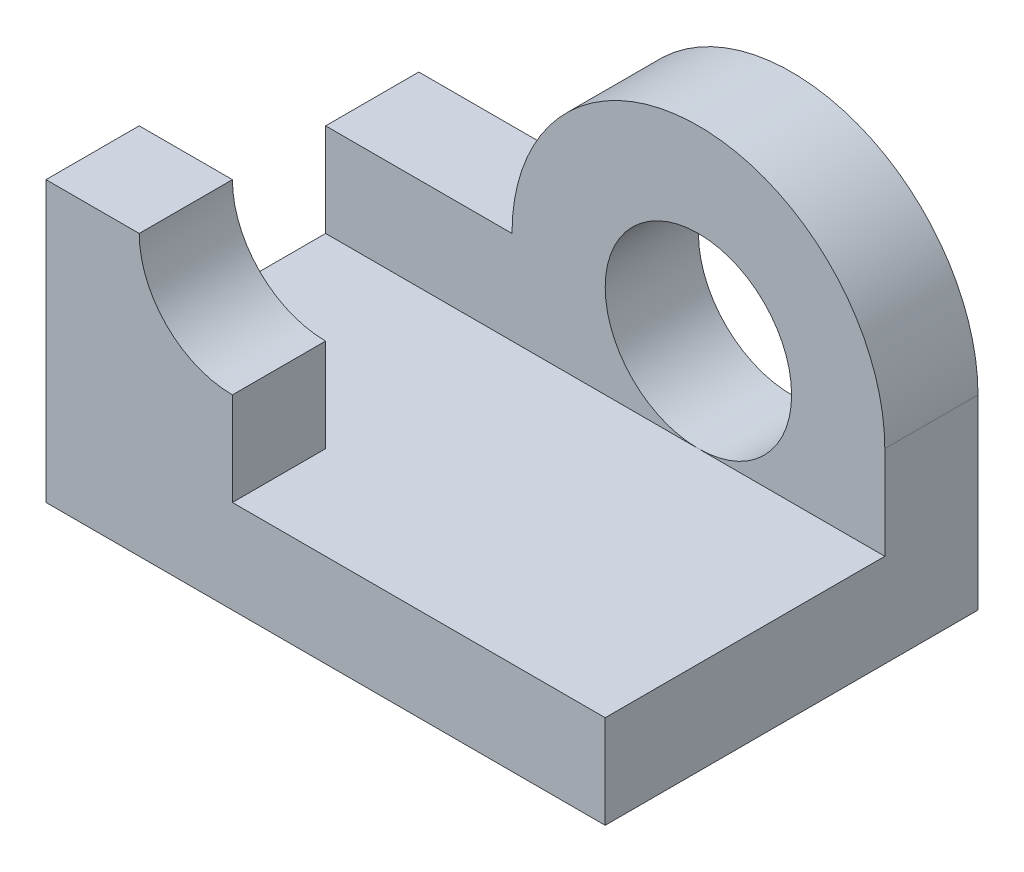
from build123d import *

# Parameters (mm, degrees)
SKETCH_1_W      = 60
SKETCH_1_H      = 40
EXTRUDE_1_DEPTH = 10
EXTRUDE_2_DEPTH = 10
SKETCH_3_W      = 20
SKETCH_3_H      = 10
EXTRUDE_6_DEPTH = 10
EXTRUDE_7_DEPTH = 10
EXTRUDE_8_DEPTH = 10


with BuildPart() as part:
    # 草圖1 → 填料-伸長1 (new body)
    with BuildSketch(Plane(origin=(0, 0, 0), x_dir=(1, 0, 0), z_dir=(0, 1, 0))):
        with Locations((30, 20)):
            Rectangle(SKETCH_1_W, SKETCH_1_H)
    extrude(amount=-EXTRUDE_1_DEPTH)

    # 草圖2 → 填料-伸長2 (add)
    with BuildSketch(Plane.XY):
        with BuildLine():
            Line((0, 0), (0, 20))
            Line((0, 20), (10, 20))
            ThreePointArc((10, 20), (12.928932188, 12.928932188), (20, 10))
            Line((20, 10), (20, 0))
            Line((20, 0), (0, 0))
        make_face()
    extrude(amount=-EXTRUDE_2_DEPTH)

    # 草圖3 → 填料-伸長6 (add)
    with BuildSketch(Plane(origin=(0, 0, -40), x_dir=(-1, 0, 0), z_dir=(0, 0, -1))):
        with Locations((-10, 5)):
            Rectangle(SKETCH_3_W, SKETCH_3_H)
    extrude(amount=-EXTRUDE_6_DEPTH)

    # 草圖3<5> → 填料-伸長7 (add)
    with BuildSketch(Plane(origin=(0, 0, -40), x_dir=(-1, 0, 0), z_dir=(0, 0, -1))):
        with BuildLine():
            Line((-60, 10), (-60, 0))
            Line((-60, 0), (-40, 0))
            ThreePointArc((-40, 0), (-47.071067812, 2.928932188), (-50, 10))
            Line((-50, 10), (-60, 10))
        make_face()
        with BuildLine():
            ThreePointArc((-30, 10), (-32.928932188, 2.928932188), (-40, 0))
            Line((-40, 0), (-20, 0))
            Line((-20, 0), (-20, 10))
            Line((-20, 10), (-30, 10))
        make_face()
    extrude(amount=-EXTRUDE_7_DEPTH)

    # 草圖3<6> → 填料-伸長8 (add)
    with BuildSketch(Plane(origin=(0, 0, -40), x_dir=(-1, 0, 0), z_dir=(0, 0, -1))):
        with BuildLine():
            ThreePointArc((-20, 10), (-40, 30), (-60, 10))
            Line((-60, 10), (-50, 10))
            ThreePointArc((-50, 10), (-40, 20), (-30, 10))
            Line((-30, 10), (-20, 10))
        make_face()
    extrude(amount=-EXTRUDE_8_DEPTH)


solid = part.part
